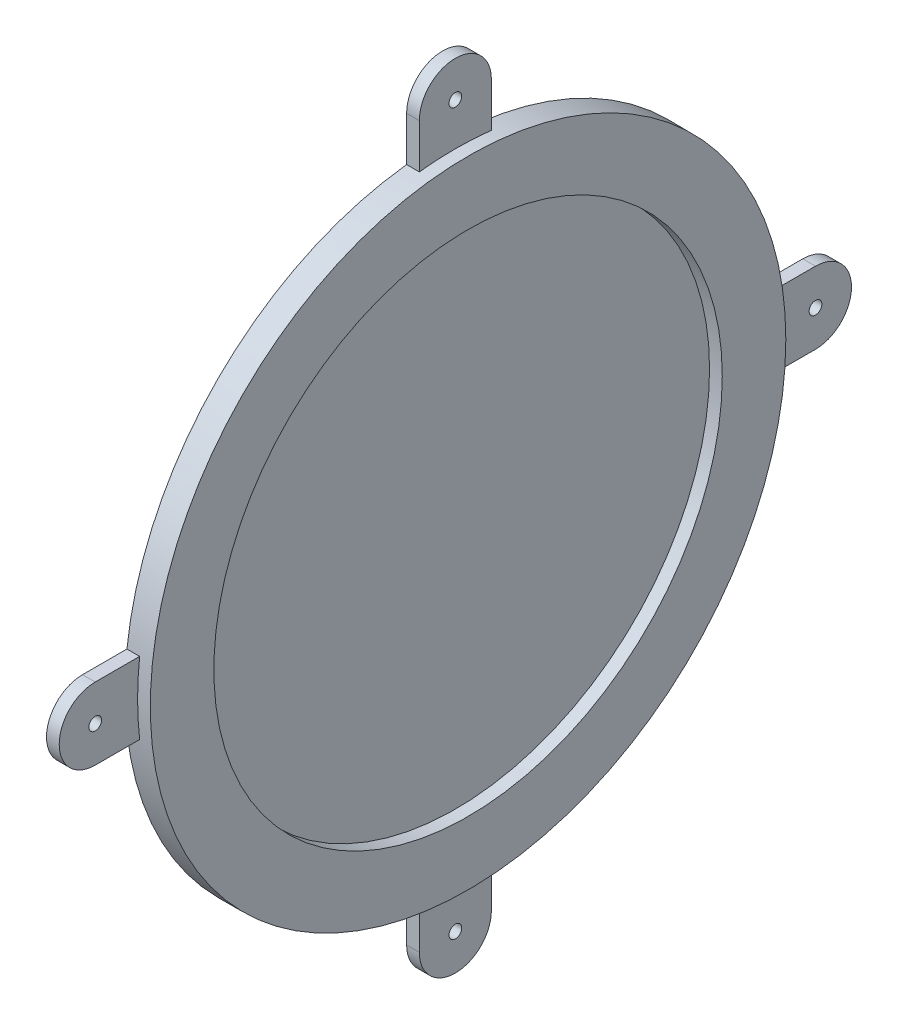
from build123d import *

# Parameters (mm, degrees)
SKETCH_1_R      = 75
SKETCH_1_R_2    = 1.5
EXTRUDE_1_DEPTH = 3
SKETCH_2_R      = 75
SKETCH_2_R_2    = 60
EXTRUDE_2_DEPTH = 3


with BuildPart() as part:
    # Эскиз1 → Бобышка-Вытянуть1 (new body)
    # profile 1 of 5: a face of its own
    with BuildSketch(Plane(origin=(0, 0, 0), x_dir=(0, 0, -1), z_dir=(1, 0, 0))):
        Circle(SKETCH_1_R)
    # profile 2 of 5: a face of its own
    with BuildSketch(Plane(origin=(0, 0, 0), x_dir=(0, 0, -1), z_dir=(1, 0, 0))):
        with BuildLine():
            ThreePointArc((-8.5, 74.516776635), (0, 75), (8.5, 74.516776635))
            Line((8.5, 74.516776635), (8.5, 85))
            ThreePointArc((8.5, 85), (0, 93.5), (-8.5, 85))
            Line((-8.5, 85), (-8.5, 74.516776635))
        make_face()
        with BuildLine():
            ThreePointArc((0, 83.5), (-1.060660172, 86.060660172), (1.5, 85))
            ThreePointArc((1.5, 85), (1.060660172, 83.939339828), (0, 83.5))
        make_face(mode=Mode.SUBTRACT)
    # profile 3 of 5: a face of its own
    with BuildSketch(Plane(origin=(0, 0, 0), x_dir=(0, 0, -1), z_dir=(1, 0, 0))):
        with BuildLine():
            ThreePointArc((85, -8.5), (93.5, 0), (85, 8.5))
            Line((85, 8.5), (74.516776635, 8.5))
            ThreePointArc((74.516776635, 8.5), (74.879096708, 4.256862249), (75, 0))
            ThreePointArc((75, 0), (74.879096708, -4.256862249), (74.516776635, -8.5))
            Line((74.516776635, -8.5), (85, -8.5))
        make_face()
        with BuildLine():
            ThreePointArc((83.5, 0), (85, 1.5), (86.5, 0))
            ThreePointArc((86.5, 0), (85, -1.5), (83.5, 0))
        make_face(mode=Mode.SUBTRACT)
    # profile 4 of 5: a face of its own
    with BuildSketch(Plane(origin=(0, 0, 0), x_dir=(0, 0, -1), z_dir=(1, 0, 0))):
        with BuildLine():
            Line((8.5, -85), (8.5, -74.516776635))
            ThreePointArc((8.5, -74.516776635), (0, -75), (-8.5, -74.516776635))
            Line((-8.5, -74.516776635), (-8.5, -85))
            ThreePointArc((-8.5, -85), (0, -93.5), (8.5, -85))
        make_face()
        with BuildLine():
            ThreePointArc((0, -83.5), (1.060660172, -83.939339828), (1.5, -85))
            ThreePointArc((1.5, -85), (-1.060660172, -86.060660172), (0, -83.5))
        make_face(mode=Mode.SUBTRACT)
    # profile 5 of 5: a face of its own
    with BuildSketch(Plane(origin=(0, 0, 0), x_dir=(0, 0, -1), z_dir=(1, 0, 0))):
        with BuildLine():
            ThreePointArc((-74.516776635, -8.5), (-75, 0), (-74.516776635, 8.5))
            Line((-74.516776635, 8.5), (-85, 8.5))
            ThreePointArc((-85, 8.5), (-93.5, 0), (-85, -8.5))
            Line((-85, -8.5), (-74.516776635, -8.5))
        make_face()
        with Locations((-85, 0)):
            Circle(SKETCH_1_R_2, mode=Mode.SUBTRACT)
    extrude(amount=EXTRUDE_1_DEPTH)

    # Эскиз2 → Бобышка-Вытянуть2 (add)
    with BuildSketch(Plane(origin=(3, 0, 0), x_dir=(0, 0, -1), z_dir=(1, 0, 0))):
        with Locations(Location((0, 0, 0), (0, 0, 173.492496408))):
            Circle(SKETCH_2_R)
        Circle(SKETCH_2_R_2, mode=Mode.SUBTRACT)
    extrude(amount=EXTRUDE_2_DEPTH)


solid = part.part
